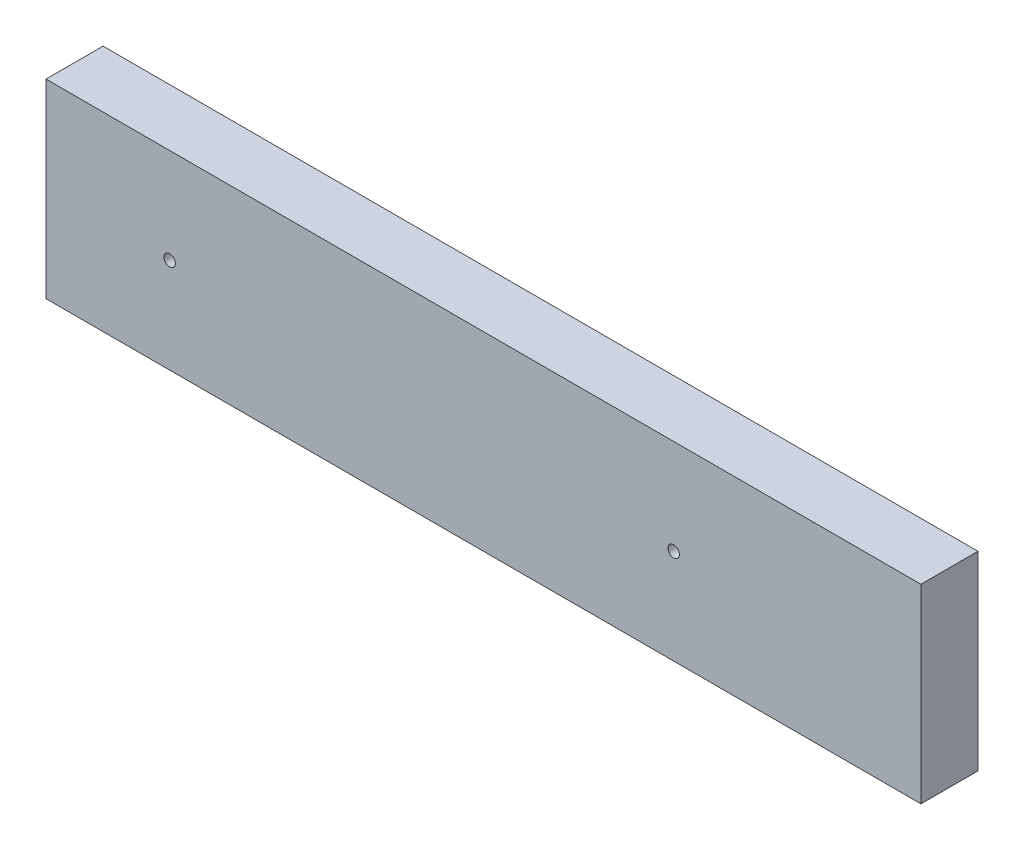
from build123d import *

# Parameters (mm, degrees)
SKETCH1_W           = 460
SKETCH1_H           = 100
BOSS_EXTRUDE1_DEPTH = 30
SKETCH2_R           = 3
CUT_EXTRUDE1_DEPTH  = 238.276210354


with BuildPart() as part:
    # Sketch1 → Boss-Extrude1 (new body)
    with BuildSketch(Plane.XY):
        Rectangle(SKETCH1_W, SKETCH1_H)
    extrude(amount=BOSS_EXTRUDE1_DEPTH)

    # Sketch2 → Cut-Extrude1 (cut, through all)
    with BuildSketch(Plane.XY):
        with Locations((100, 0)):
            Circle(SKETCH2_R)
        with Locations((-165, 0)):
            Circle(SKETCH2_R)
    extrude(amount=CUT_EXTRUDE1_DEPTH, mode=Mode.SUBTRACT)


solid = part.part
